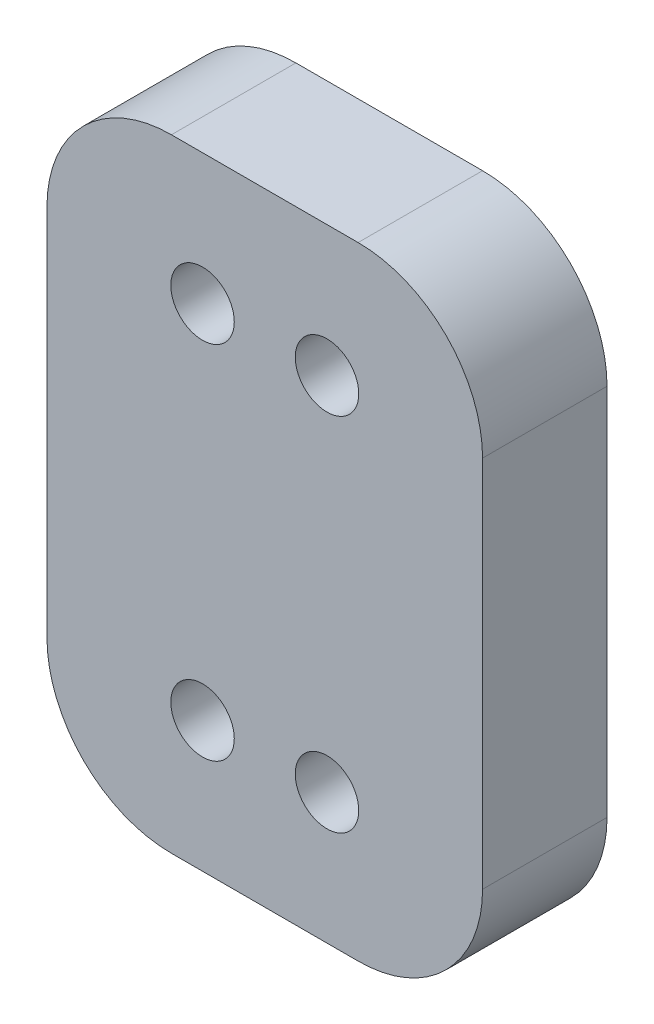
from build123d import *

# Parameters (mm, degrees)
SZKIC2_R                    = 2.55
DODANIE_WYCI_GNI_CIE1_DEPTH = 10


with BuildPart() as part:
    # Szkic2 → Dodanie-wyciągnięcie1 (new body)
    with BuildSketch(Plane.XY):
        with BuildLine():
            Line((6.47718246, 717.237393461), (6.47718246, 747.237393461))
            ThreePointArc((6.47718246, 747.237393461), (3.548250272, 754.308461273), (-3.52281754, 757.237393461))
            Line((-3.52281754, 757.237393461), (-18.52281754, 757.237393461))
            ThreePointArc((-18.52281754, 757.237393461), (-25.593885352, 754.308461273), (-28.52281754, 747.237393461))
            Line((-28.52281754, 747.237393461), (-28.52281754, 717.237393461))
            ThreePointArc((-28.52281754, 717.237393461), (-25.593885352, 710.16632565), (-18.52281754, 707.237393461))
            Line((-18.52281754, 707.237393461), (-3.52281754, 707.237393461))
            ThreePointArc((-3.52281754, 707.237393461), (3.548250272, 710.16632565), (6.47718246, 717.237393461))
        make_face()
        with Locations((-16.02281754, 746.737393463)):
            Circle(SZKIC2_R, mode=Mode.SUBTRACT)
        with Locations((-6.02281754, 746.737393463)):
            Circle(SZKIC2_R, mode=Mode.SUBTRACT)
        with Locations((-6.02281754, 717.737393463)):
            Circle(SZKIC2_R, mode=Mode.SUBTRACT)
        with Locations((-16.02281754, 717.737393463)):
            Circle(SZKIC2_R, mode=Mode.SUBTRACT)
    extrude(amount=DODANIE_WYCI_GNI_CIE1_DEPTH)


solid = part.part
